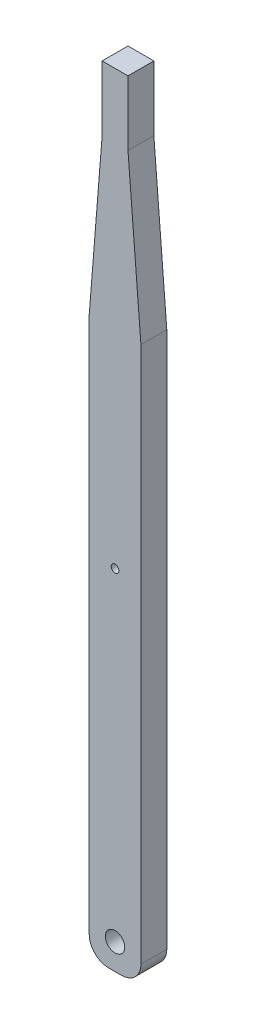
from build123d import *

# Parameters (mm, degrees)
SKETCH1_W             = 8
SKETCH1_H             = 121
BOSS_EXTRUDE1_DEPTH   = 4
FILLET1_R             = 3
CUT_EXTRUDE1_DEPTH    = 4
F_1_0MM_DOWEL_HOLE1_D = 3
SKETCH6_R             = 0.6
CUT_EXTRUDE2_DEPTH    = 10


with BuildPart() as part:
    # Sketch1 → Boss-Extrude1 (new body)
    with BuildSketch(Plane.XY):
        Rectangle(SKETCH1_W, SKETCH1_H)
    extrude(amount=BOSS_EXTRUDE1_DEPTH)

    # Fillet1
    fillet1_edges = [part.edges().sort_by_distance(p)[0] for p in [
        (4, -60.5, 2),
        (-4, -60.5, 2),
    ]]
    fillet(fillet1_edges, radius=FILLET1_R)

    # Sketch2 → Cut-Extrude1 (cut)
    with BuildSketch(Plane.XY.offset(4)):
        Polygon((-4, 25.5), (-2, 50.5), (-2, 60.5), (-4, 60.5), align=None)
        Polygon((2, 60.5), (2, 50.5), (4, 25.5), (4, 60.5), align=None)
    extrude(amount=-CUT_EXTRUDE1_DEPTH, mode=Mode.SUBTRACT)

    # Ø1.0mm Dowel Hole1 (through all)
    with Locations(Plane.XY.offset(4)):
        with Locations((0, -56.5)):
            Hole(F_1_0MM_DOWEL_HOLE1_D / 2)

    # Sketch6 → Cut-Extrude2 (cut)
    with BuildSketch(Plane.XY.offset(4)):
        with Locations((0, -6.5)):
            Circle(SKETCH6_R)
    extrude(amount=-CUT_EXTRUDE2_DEPTH, mode=Mode.SUBTRACT)


solid = part.part
